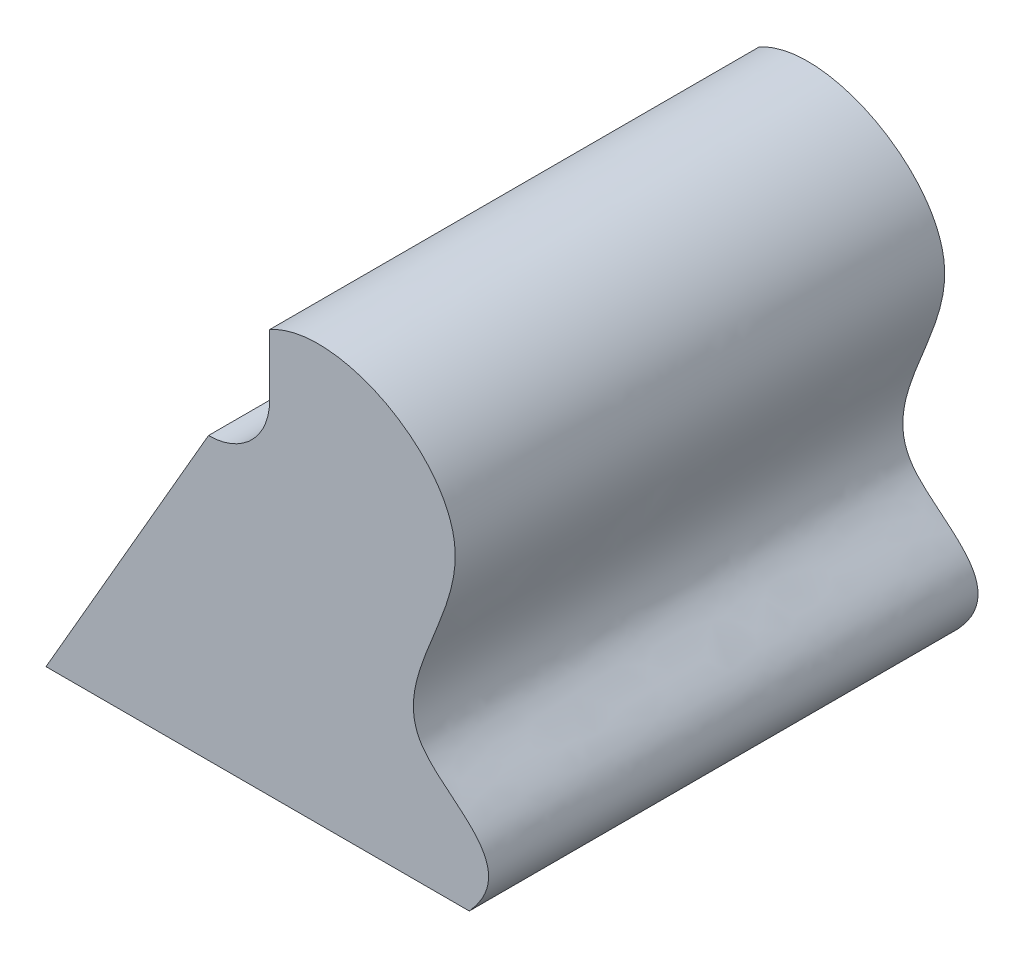
from build123d import *

# Parameters (mm, degrees)
BOSS_EXTRU_1_DEPTH = 20


with BuildPart() as part:
    # Esquisse1 → Boss.-Extru.1 (new, symmetric)
    with BuildSketch(Plane.XY):
        with BuildLine():
            Line((2.757835538, 0), (37.350688144, 0))
            add(Edge.make_bspline(
                [(37.350688144, 0), (41.962405292, 5.087288514), (26.683241818, 9.133861582), (43.232235369, 27.239644515), (26.656278771, 36.134424551), (21.036891729, 33)],
                knots=[0, 0, 0, 0, 0.263847528, 0.594826113, 1, 1, 1, 1], degree=3))
            Line((21.036891729, 33), (21.036891729, 28))
            ThreePointArc((21.036891729, 28), (19.572425635, 24.464466094), (16.036891729, 23))
            Line((16.036891729, 23), (2.757835538, 0))
        make_face()
    extrude(amount=BOSS_EXTRU_1_DEPTH, both=True)


solid = part.part
